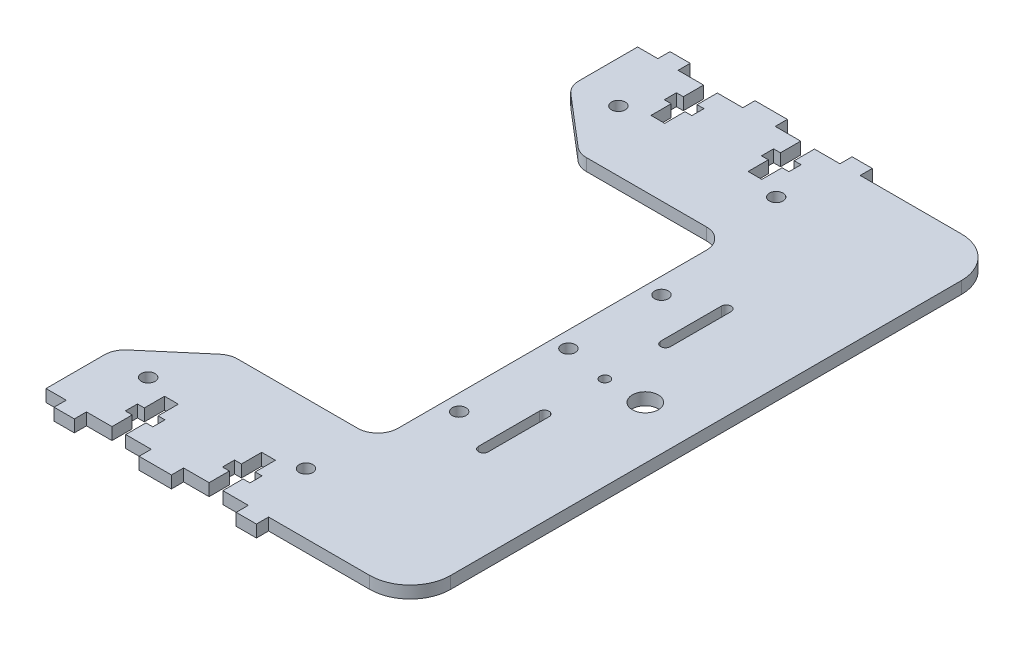
from build123d import *

# Parameters (mm, degrees)
EXTRUDE_1_DEPTH     = 3
SKETCH_2_W          = 5
SKETCH_2_H          = 3
CUT_EXTRUDE_1_DEPTH = 176
SKETCH_3_W          = 146.2
SKETCH_3_H          = 3
EXTRUDE_2_DEPTH     = 5
SKETCH_4_R          = 1.7
CUT_EXTRUDE_2_DEPTH = 5
CUT_EXTRUDE_3_DEPTH = 10
FILLET_1_R          = 5
SKETCH_7_W          = 146.2
SKETCH_7_H          = 3
EXTRUDE_3_DEPTH     = 20
SKETCH_8_R          = 3.2
CUT_EXTRUDE_4_DEPTH = 20
SKETCH_9_R          = 1.2
CUT_EXTRUDE_5_DEPTH = 20
FILLET_2_R          = 10
SKETCH_10_R         = 1.7
CUT_EXTRUDE_6_DEPTH = 3


with BuildPart() as part:
    # 草图1 → 凸台-拉伸1 (new body)
    with BuildSketch(Plane(origin=(0, 0, 0), x_dir=(1, 0, 0), z_dir=(0, 1, 0))):
        Polygon((-25, -73.1), (-25, -76.1), (-20, -76.1), (-20, -73.1), (-13.7, -73.1), (-13.7, -68.1), (-15.4, -68.1), (-15.4, -65.1), (-13.7, -65.1), (-13.7, -60.1), (-10.3, -60.1), (-10.3, -65.1), (-8.6, -65.1), (-8.6, -68.1), (-10.3, -68.1), (-10.3, -73.1), (-4, -73.1), (-4, -76.1), (4, -76.1), (4, -73.1), (10.3, -73.1), (10.3, -68.1), (8.6, -68.1), (8.6, -65.1), (10.3, -65.1), (10.3, -60.1), (13.7, -60.1), (13.7, -65.1), (15.4, -65.1), (15.4, -68.1), (13.7, -68.1), (13.7, -73.1), (20, -73.1), (20, -76.1), (25, -76.1), (25, -73.1), (35, -73.1), (35, 73.1), (25, 73.1), (25, 76.1), (20, 76.1), (20, 73.1), (13.7, 73.1), (13.7, 68.1), (15.4, 68.1), (15.4, 65.1), (13.7, 65.1), (13.7, 60.1), (10.3, 60.1), (10.3, 65.1), (8.6, 65.1), (8.6, 68.1), (10.3, 68.1), (10.3, 73.1), (4, 73.1), (4, 76.1), (-4, 76.1), (-4, 73.1), (-10.3, 73.1), (-10.3, 68.1), (-8.6, 68.1), (-8.6, 65.1), (-10.3, 65.1), (-10.3, 60.1), (-13.7, 60.1), (-13.7, 65.1), (-15.4, 65.1), (-15.4, 68.1), (-13.7, 68.1), (-13.7, 73.1), (-20, 73.1), (-20, 76.1), (-25, 76.1), (-25, 73.1), (-35, 73.1), (-35, -73.1), align=None)
    extrude(amount=EXTRUDE_1_DEPTH)

    # 草图2 → 切除-拉伸1 (cut)
    with BuildSketch(Plane.XY.offset(73.1)):
        with Locations((-32.5, 1.5)):
            Rectangle(SKETCH_2_W, SKETCH_2_H)
    extrude(amount=-CUT_EXTRUDE_1_DEPTH, mode=Mode.SUBTRACT)

    # 草图3 → 凸台-拉伸2 (add)
    with BuildSketch(Plane(origin=(35, 0, 0), x_dir=(0, 0, -1), z_dir=(1, 0, 0))):
        with Locations((0, 1.5)):
            Rectangle(SKETCH_3_W, SKETCH_3_H)
    extrude(amount=EXTRUDE_2_DEPTH)

    # 草图4 → 切除-拉伸2 (cut)
    with BuildSketch(Plane(origin=(0, 3, 0), x_dir=(1, 0, 0), z_dir=(0, 1, 0))):
        with Locations(Location((-19.75, -58.1, 0), (0, 0, 270))):
            Circle(SKETCH_4_R)
        with Locations(Location((19.25, -58.1, 0), (0, 0, 270))):
            Circle(SKETCH_4_R)
        with Locations(Location((19.25, 58.1, 0), (0, 0, 270))):
            Circle(SKETCH_4_R)
        with Locations(Location((-19.75, 58.1, 0), (0, 0, 270))):
            Circle(SKETCH_4_R)
    extrude(amount=-CUT_EXTRUDE_2_DEPTH, mode=Mode.SUBTRACT)

    # 草图5 → 切除-拉伸3 (cut)
    with BuildSketch(Plane(origin=(0, 3, 0), x_dir=(1, 0, 0), z_dir=(0, 1, 0))):
        Polygon((-30, -56.331395183), (-14.5, -43.1), (0, -43.1), (22, -43.1), (22, 43.1), (-14.5, 43.1), (-30, 56.331395183), align=None)
    extrude(amount=-CUT_EXTRUDE_3_DEPTH, mode=Mode.SUBTRACT)

    # 圆角1
    fillet_1_edges = [part.edges().sort_by_distance(p)[0] for p in [
        (-30, 1.5, 56.331395183),
        (-30, 1.5, -56.331395183),
        (-14.5, 1.5, -43.1),
        (22, 1.5, -43.1),
        (22, 1.5, 43.1),
        (-14.5, 1.5, 43.1),
    ]]
    fillet(fillet_1_edges, radius=FILLET_1_R)

    # 草图7 → 凸台-拉伸3 (add)
    with BuildSketch(Plane(origin=(40, 0, 0), x_dir=(0, 0, -1), z_dir=(1, 0, 0))):
        with Locations((0, 1.5)):
            Rectangle(SKETCH_7_W, SKETCH_7_H)
    extrude(amount=EXTRUDE_3_DEPTH)

    # 草图8 → 切除-拉伸4 (cut)
    with BuildSketch(Plane(origin=(0, 3, 0), x_dir=(1, 0, 0), z_dir=(0, 1, 0))):
        with Locations(Location((47, -2, 0), (0, 0, 270))):
            Circle(SKETCH_8_R)
    extrude(amount=-CUT_EXTRUDE_4_DEPTH, mode=Mode.SUBTRACT)

    # 草图9 → 切除-拉伸5 (cut)
    with BuildSketch(Plane(origin=(0, 3, 0), x_dir=(1, 0, 0), z_dir=(0, 1, 0))):
        with Locations(Location((37, -2, 0), (0, 0, 270))):
            Circle(SKETCH_9_R)
        with BuildLine():
            Line((35.8, 13), (35.8, 28))
            ThreePointArc((35.8, 28), (37, 29.2), (38.2, 28))
            Line((38.2, 28), (38.2, 13))
            ThreePointArc((38.2, 13), (37, 11.8), (35.8, 13))
        make_face()
        with BuildLine():
            Line((38.2, -17), (38.2, -32))
            ThreePointArc((38.2, -32), (37, -33.2), (35.8, -32))
            Line((35.8, -32), (35.8, -17))
            ThreePointArc((35.8, -17), (37, -15.8), (38.2, -17))
        make_face()
    extrude(amount=-CUT_EXTRUDE_5_DEPTH, mode=Mode.SUBTRACT)

    # 圆角2
    fillet_2_edges = [part.edges().sort_by_distance(p)[0] for p in [
        (60, 1.5, 73.1),
        (60, 1.5, -73.1),
    ]]
    fillet(fillet_2_edges, radius=FILLET_2_R)

    # 草图10 → 切除-拉伸6 (cut)
    with BuildSketch(Plane(origin=(0, 3, 0), x_dir=(1, 0, 0), z_dir=(0, 1, 0))):
        with Locations(Location((26, -27, 0), (0, 0, 270))):
            Circle(SKETCH_10_R)
        with Locations(Location((26, 23, 0), (0, 0, 270))):
            Circle(SKETCH_10_R)
        with Locations(Location((26, 0, 0), (0, 0, 270))):
            Circle(SKETCH_10_R)
    extrude(amount=-CUT_EXTRUDE_6_DEPTH, mode=Mode.SUBTRACT)


solid = part.part
